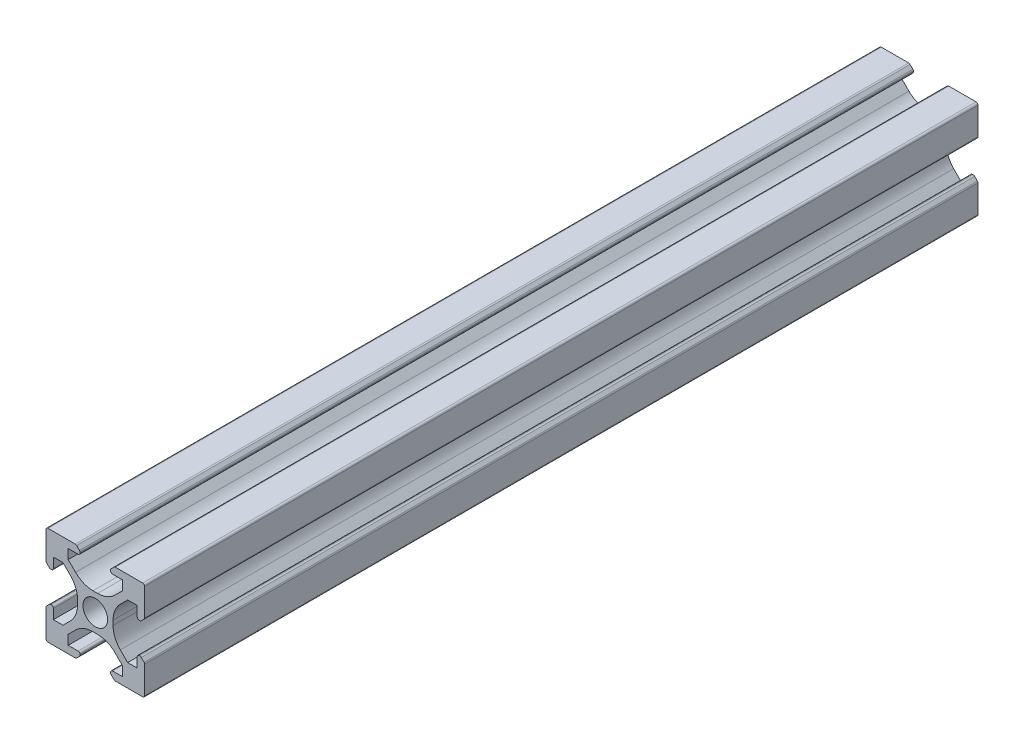
from build123d import *

# Parameters (mm, degrees)
RESSALTO_EXTRUS_O1_DEPTH = 169
PADR_OCIRCULAR1_COUNT    = 4
FILETE1_R                = 0.4


with BuildPart() as part:
    # Esboço1 → Ressalto-extrusão1 (new body)
    with BuildSketch(Plane.XY):
        with BuildLine():
            ThreePointArc((-9.317157288, 3.217157288), (-9.187387948, 3.130448187), (-9.034314575, 3.1))
            Line((-9.034314575, 3.1), (-8.9, 3.1))
            ThreePointArc((-8.9, 3.1), (-8.617157288, 3.217157288), (-8.5, 3.5))
            Line((-8.5, 3.5), (-8.5, 5.5))
            Line((-8.5, 5.5), (-6.560660172, 5.5))
            Line((-6.560660172, 5.5), (-5.064466094, 4.003805922))
            ThreePointArc((-5.064466094, 4.003805922), (-3.980602337, 2.381689178), (-3.6, 0.468272016))
            Line((-3.6, 0.468272016), (-3.6, 0))
            Line((-3.6, 0), (-2.5, 0))
            ThreePointArc((-2.5, 0), (-1.767766953, 1.767766953), (0, 2.5))
            Line((0, 2.5), (0, 3.6))
            Line((0, 3.6), (-0.468272016, 3.6))
            ThreePointArc((-0.468272016, 3.6), (-2.381689178, 3.980602337), (-4.003805922, 5.064466094))
            Line((-4.003805922, 5.064466094), (-5.5, 6.560660172))
            Line((-5.5, 6.560660172), (-5.5, 8.5))
            Line((-5.5, 8.5), (-3.5, 8.5))
            ThreePointArc((-3.5, 8.5), (-3.217157288, 8.617157288), (-3.1, 8.9))
            Line((-3.1, 8.9), (-3.1, 9.034314575))
            ThreePointArc((-3.1, 9.034314575), (-3.130448187, 9.187387948), (-3.217157288, 9.317157288))
            Line((-3.217157288, 9.317157288), (-3.782842712, 9.882842712))
            ThreePointArc((-3.782842712, 9.882842712), (-3.912612052, 9.969551813), (-4.065685425, 10))
            Line((-4.065685425, 10), (-10, 10))
            Line((-10, 10), (-10, 4.065685425))
            ThreePointArc((-10, 4.065685425), (-9.969551813, 3.912612052), (-9.882842712, 3.782842712))
            Line((-9.882842712, 3.782842712), (-9.317157288, 3.217157288))
        make_face()
    ressalto_extrus_o1 = extrude(amount=RESSALTO_EXTRUS_O1_DEPTH)

    # PadrãoCircular1: Ressalto-extrusão1 ×4 about axis
    padr_ocircular1_axis = Axis((0, 0, 0), (0, 0, 1))
    for i in range(1, PADR_OCIRCULAR1_COUNT):
        add(ressalto_extrus_o1.rotate(padr_ocircular1_axis, i * 360 / PADR_OCIRCULAR1_COUNT))

    # Filete1
    filete1_edges = [part.edges().sort_by_distance(p)[0] for p in [
        (10, -10, 84.5),
        (10, 10, 84.5),
        (-10, 10, 84.5),
        (-10, -10, 84.5),
    ]]
    fillet(filete1_edges, radius=FILETE1_R)


solid = part.part
